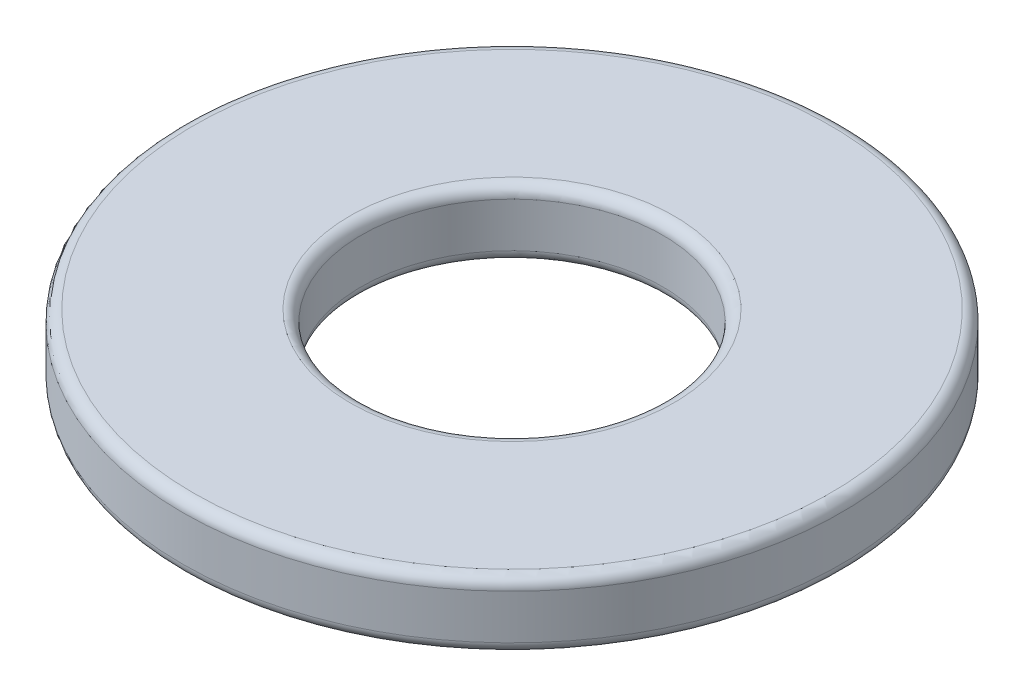
from build123d import *

# Parameters (mm, degrees)
MAIN_SKETCH_R     = 5.9
MAIN_SKETCH_R_2   = 2.7
WASHER_MAIN_DEPTH = 1.2
EDGE_FILLETS_R    = 0.2


with BuildPart() as part:
    # Main Sketch → Washer Main (new body)
    with BuildSketch(Plane(origin=(0, 0, 0), x_dir=(1, 0, 0), z_dir=(0, 1, 0))):
        with Locations(Location((0, 0, 0), (0, 0, 270))):
            Circle(MAIN_SKETCH_R)
        with Locations(Location((0, 0, 0), (0, 0, 270))):
            Circle(MAIN_SKETCH_R_2, mode=Mode.SUBTRACT)
    extrude(amount=WASHER_MAIN_DEPTH)

    # Edge Fillets
    edge_fillets_edges = [part.edges().sort_by_distance(p)[0] for p in [
        (0, 0, -5.9),
        (0, 1.2, -5.9),
        (0, 0, -2.7),
        (0, 1.2, -2.7),
    ]]
    fillet(edge_fillets_edges, radius=EDGE_FILLETS_R)


solid = part.part
